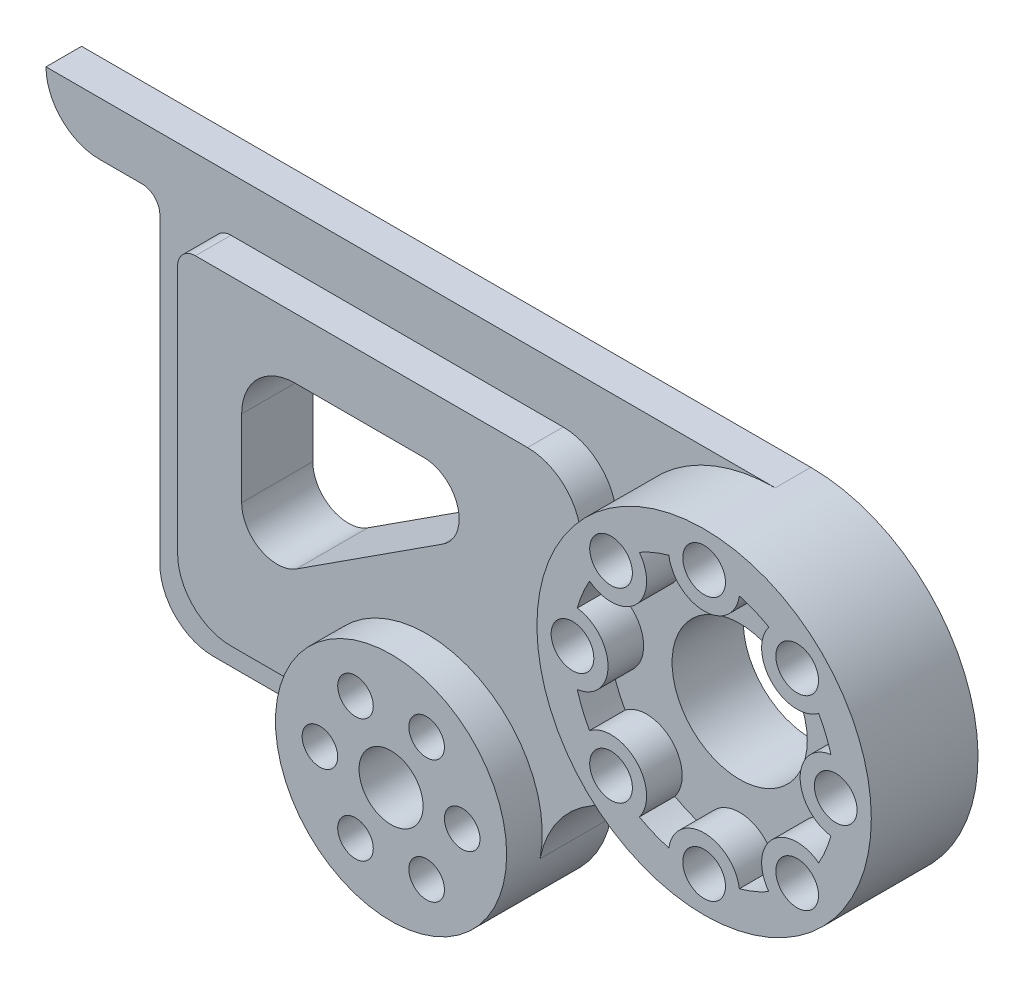
from build123d import *

# Parameters (mm, degrees)
EXTRUDE_1_DEPTH = 10
EXTRUDE_2_DEPTH = 20
SKETCH_1_4_R    = 47
SKETCH_1_4_R_2  = 6
SKETCH_1_4_R_3  = 32.5
SKETCH_1_4_R_4  = 5
SKETCH_1_4_R_5  = 9
EXTRUDE_3_DEPTH = 30
SKETCH_1_5_R    = 19
EXTRUDE_4_DEPTH = 20


with BuildPart() as part:
    # Эскиз1 → Бобышка-Вытянуть1 (new body)
    with BuildSketch(Plane.XY):
        with BuildLine():
            ThreePointArc((-45.198702821, 12.887096774), (-28.313481344, 37.514620806), (0, 47))
            Line((0, 47), (-205, 47))
            ThreePointArc((-205, 47), (-200.606601718, 36.393398282), (-190, 32))
            Line((-190, 32), (-178, 32))
            ThreePointArc((-178, 32), (-174.464466094, 30.535533906), (-173, 27))
            Line((-173, 27), (-173, -58))
            ThreePointArc((-173, -58), (-168.606601718, -68.606601718), (-158, -73))
            Line((-158, -73), (-126.369910086, -73))
            ThreePointArc((-126.369910086, -73), (-119.574013491, -74.627797882), (-114.253096375, -79.157894737))
            ThreePointArc((-114.253096375, -79.157894737), (-120.019995674, -65.565058581), (-119.177594319, -50.823529412))
            ThreePointArc((-119.177594319, -50.823529412), (-122.780512208, -56.007349565), (-128.770700264, -58))
            Line((-128.770700264, -58), (-143, -58))
            ThreePointArc((-143, -58), (-153.606601718, -53.606601718), (-158, -43))
            Line((-158, -43), (-158, 27))
            ThreePointArc((-158, 27), (-156.535533906, 30.535533906), (-153, 32))
            Line((-153, 32), (-59.623820743, 32))
            ThreePointArc((-59.623820743, 32), (-47.651069422, 26.03621745), (-45.198702821, 12.887096774))
        make_face()
    extrude(amount=EXTRUDE_1_DEPTH)

    # Эскиз1<3> → Бобышка-Вытянуть2 (add)
    with BuildSketch(Plane.XY):
        with BuildLine():
            ThreePointArc((-16.3012652, -44.08252208), (-41.915938314, -21.261564271), (-45.198702821, 12.887096774))
            ThreePointArc((-45.198702821, 12.887096774), (-47.651069422, 26.03621745), (-59.623820743, 32))
            Line((-59.623820743, 32), (-153, 32))
            ThreePointArc((-153, 32), (-156.535533906, 30.535533906), (-158, 27))
            Line((-158, 27), (-158, -43))
            ThreePointArc((-158, -43), (-153.606601718, -53.606601718), (-143, -58))
            Line((-143, -58), (-128.770700264, -58))
            ThreePointArc((-128.770700264, -58), (-122.780512208, -56.007349565), (-119.177594319, -50.823529412))
            ThreePointArc((-119.177594319, -50.823529412), (-83.364367108, -27.832300242), (-55.5, -60))
            ThreePointArc((-55.5, -60), (-55.657202848, -63.192721783), (-56.127290608, -66.354557108))
            ThreePointArc((-56.127290608, -66.354557108), (-41.349141883, -46.036566638), (-16.3012652, -44.08252208))
        make_face()
        with BuildLine():
            ThreePointArc((-88.862233392, 15), (-79.271690766, 7.832223886), (-83.429720611, -3.395701572))
            Line((-83.429720611, -3.395701572), (-124.567487218, -30.014256435))
            ThreePointArc((-124.567487218, -30.014256435), (-134.77885301, -30.402777306), (-140, -21.618554864))
            Line((-140, -21.618554864), (-140, 0))
            ThreePointArc((-140, 0), (-135.606601718, 10.606601718), (-125, 15))
            Line((-125, 15), (-88.862233392, 15))
        make_face(mode=Mode.SUBTRACT)
    extrude(amount=EXTRUDE_2_DEPTH)

    # Эскиз1<4> → Бобышка-Вытянуть3 (add)
    # profile 1 of 2: a face of its own
    with BuildSketch(Plane.XY):
        Circle(SKETCH_1_4_R)
        with Locations((-26.162950904, -26.162950904)):
            Circle(SKETCH_1_4_R_2, mode=Mode.SUBTRACT)
        with Locations((0, -37)):
            Circle(SKETCH_1_4_R_2, mode=Mode.SUBTRACT)
        with Locations((26.162950904, -26.162950904)):
            Circle(SKETCH_1_4_R_2, mode=Mode.SUBTRACT)
        with Locations((-37, 0)):
            Circle(SKETCH_1_4_R_2, mode=Mode.SUBTRACT)
        with BuildLine():
            ThreePointArc((-32.21360736, 18.201195039), (-19.091883092, 19.091883092), (-18.201195039, 32.21360736))
            ThreePointArc((-18.201195039, 32.21360736), (-14.159286998, 34.183542703), (-9.908271773, 35.648648649))
            ThreePointArc((-9.908271773, 35.648648649), (0, 27), (9.908271773, 35.648648649))
            ThreePointArc((9.908271773, 35.648648649), (14.159286998, 34.183542703), (18.201195039, 32.21360736))
            ThreePointArc((18.201195039, 32.21360736), (19.091883092, 19.091883092), (32.21360736, 18.201195039))
            ThreePointArc((32.21360736, 18.201195039), (34.183542703, 14.159286998), (35.648648649, 9.908271773))
            ThreePointArc((35.648648649, 9.908271773), (27, 0), (35.648648649, -9.908271773))
            ThreePointArc((35.648648649, -9.908271773), (34.183542703, -14.159286998), (32.21360736, -18.201195039))
            ThreePointArc((32.21360736, -18.201195039), (19.091883092, -19.091883092), (18.201195039, -32.21360736))
            ThreePointArc((18.201195039, -32.21360736), (14.159286998, -34.183542703), (9.908271773, -35.648648649))
            ThreePointArc((9.908271773, -35.648648649), (0, -27), (-9.908271773, -35.648648649))
            ThreePointArc((-9.908271773, -35.648648649), (-14.159286998, -34.183542703), (-18.201195039, -32.21360736))
            ThreePointArc((-18.201195039, -32.21360736), (-19.091883092, -19.091883092), (-32.21360736, -18.201195039))
            ThreePointArc((-32.21360736, -18.201195039), (-34.183542703, -14.159286998), (-35.648648649, -9.908271773))
            ThreePointArc((-35.648648649, -9.908271773), (-27, 0), (-35.648648649, 9.908271773))
            ThreePointArc((-35.648648649, 9.908271773), (-34.183542703, 14.159286998), (-32.21360736, 18.201195039))
        make_face(mode=Mode.SUBTRACT)
        with Locations((37, 0)):
            Circle(SKETCH_1_4_R_2, mode=Mode.SUBTRACT)
        with Locations((-26.162950904, 26.162950904)):
            Circle(SKETCH_1_4_R_2, mode=Mode.SUBTRACT)
        with Locations((26.162950904, 26.162950904)):
            Circle(SKETCH_1_4_R_2, mode=Mode.SUBTRACT)
        with Locations((0, 37)):
            Circle(SKETCH_1_4_R_2, mode=Mode.SUBTRACT)
    # profile 2 of 2: a face of its own
    with BuildSketch(Plane.XY):
        with Locations((-88, -60)):
            Circle(SKETCH_1_4_R_3)
        with Locations((-98, -77.320508076)):
            Circle(SKETCH_1_4_R_4, mode=Mode.SUBTRACT)
        with Locations((-108, -60)):
            Circle(SKETCH_1_4_R_4, mode=Mode.SUBTRACT)
        with Locations((-88, -60)):
            Circle(SKETCH_1_4_R_5, mode=Mode.SUBTRACT)
        with Locations((-98, -42.679491924)):
            Circle(SKETCH_1_4_R_4, mode=Mode.SUBTRACT)
        with Locations((-78, -77.320508076)):
            Circle(SKETCH_1_4_R_4, mode=Mode.SUBTRACT)
        with Locations((-68, -60)):
            Circle(SKETCH_1_4_R_4, mode=Mode.SUBTRACT)
        with Locations((-78, -42.679491924)):
            Circle(SKETCH_1_4_R_4, mode=Mode.SUBTRACT)
    extrude(amount=EXTRUDE_3_DEPTH)

    # Эскиз1<5> → Бобышка-Вытянуть4 (add)
    with BuildSketch(Plane.XY):
        with BuildLine():
            ThreePointArc((-9.908271773, 35.648648649), (-14.159286998, 34.183542703), (-18.201195039, 32.21360736))
            ThreePointArc((-18.201195039, 32.21360736), (-19.091883092, 19.091883092), (-32.21360736, 18.201195039))
            ThreePointArc((-32.21360736, 18.201195039), (-34.183542703, 14.159286998), (-35.648648649, 9.908271773))
            ThreePointArc((-35.648648649, 9.908271773), (-27, 0), (-35.648648649, -9.908271773))
            ThreePointArc((-35.648648649, -9.908271773), (-34.183542703, -14.159286998), (-32.21360736, -18.201195039))
            ThreePointArc((-32.21360736, -18.201195039), (-19.091883092, -19.091883092), (-18.201195039, -32.21360736))
            ThreePointArc((-18.201195039, -32.21360736), (-14.159286998, -34.183542703), (-9.908271773, -35.648648649))
            ThreePointArc((-9.908271773, -35.648648649), (0, -27), (9.908271773, -35.648648649))
            ThreePointArc((9.908271773, -35.648648649), (14.159286998, -34.183542703), (18.201195039, -32.21360736))
            ThreePointArc((18.201195039, -32.21360736), (19.091883092, -19.091883092), (32.21360736, -18.201195039))
            ThreePointArc((32.21360736, -18.201195039), (34.183542703, -14.159286998), (35.648648649, -9.908271773))
            ThreePointArc((35.648648649, -9.908271773), (27, 0), (35.648648649, 9.908271773))
            ThreePointArc((35.648648649, 9.908271773), (34.183542703, 14.159286998), (32.21360736, 18.201195039))
            ThreePointArc((32.21360736, 18.201195039), (19.091883092, 19.091883092), (18.201195039, 32.21360736))
            ThreePointArc((18.201195039, 32.21360736), (14.159286998, 34.183542703), (9.908271773, 35.648648649))
            ThreePointArc((9.908271773, 35.648648649), (0, 27), (-9.908271773, 35.648648649))
        make_face()
        Circle(SKETCH_1_5_R, mode=Mode.SUBTRACT)
    extrude(amount=EXTRUDE_4_DEPTH)


solid = part.part
